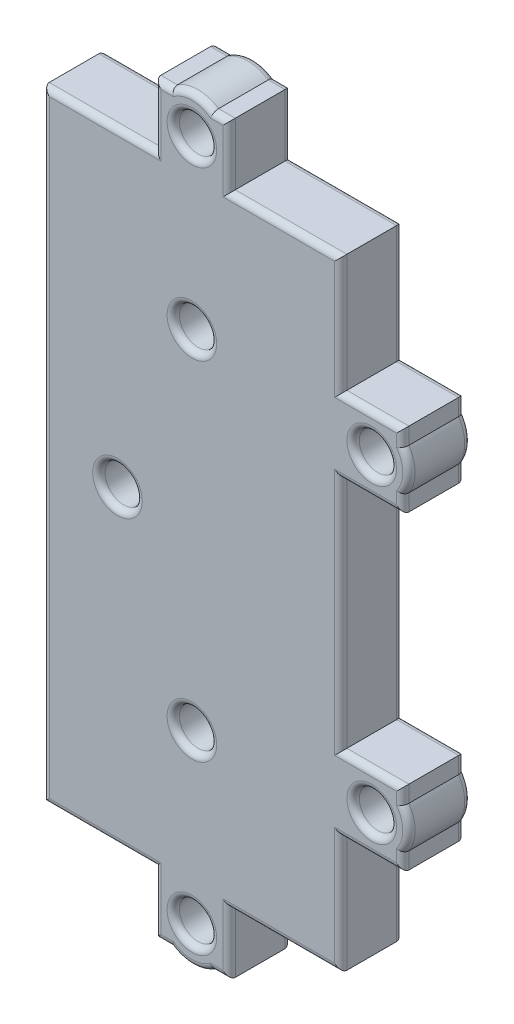
from build123d import *

# Parameters (mm, degrees)
ESQUISSE1_W             = 24
ESQUISSE1_H             = 50
ESQUISSE1_R             = 1.5
BOSS_EXTRU_1_DEPTH      = 5
ESQUISSE2_R             = 1.5
ENL_V_MAT_EXTRU_1_DEPTH = 5
CONG_1_R                = 0.5


with BuildPart() as part:
    # Esquisse1 → Boss.-Extru.1 (new body)
    # profile 1 of 5: a face of its own
    with BuildSketch(Plane.XY):
        Rectangle(ESQUISSE1_W, ESQUISSE1_H)
    # profile 2 of 5: a face of its own
    with BuildSketch(Plane.XY):
        with BuildLine():
            Line((17, 10.841687605), (17, 9.5))
            Line((17, 9.5), (12, 9.5))
            Line((12, 9.5), (12, 15.5))
            Line((12, 15.5), (17, 15.5))
            Line((17, 15.5), (17, 14.158312395))
            ThreePointArc((17, 14.158312395), (17.5, 12.5), (17, 10.841687605))
        make_face()
        with Locations((14.5, 12.5)):
            Circle(ESQUISSE1_R, mode=Mode.SUBTRACT)
    # profile 3 of 5: a face of its own
    with BuildSketch(Plane.XY):
        with BuildLine():
            Line((17, -15.5), (17, -14.158312395))
            ThreePointArc((17, -14.158312395), (17.5, -12.5), (17, -10.841687605))
            Line((17, -10.841687605), (17, -9.5))
            Line((17, -9.5), (12, -9.5))
            Line((12, -9.5), (12, -15.5))
            Line((12, -15.5), (17, -15.5))
        make_face()
        with Locations((14.5, -12.5)):
            Circle(ESQUISSE1_R, mode=Mode.SUBTRACT)
    # profile 4 of 5: a face of its own
    with BuildSketch(Plane.XY):
        with BuildLine():
            Line((1.658312395, 30), (3, 30))
            Line((3, 30), (3, 25))
            Line((3, 25), (-3, 25))
            Line((-3, 25), (-3, 30))
            Line((-3, 30), (-1.658312395, 30))
            ThreePointArc((-1.658312395, 30), (0, 30.5), (1.658312395, 30))
        make_face()
        with Locations((0, 27.5)):
            Circle(ESQUISSE1_R, mode=Mode.SUBTRACT)
    # profile 5 of 5: a face of its own
    with BuildSketch(Plane.XY):
        with BuildLine():
            Line((-3, -30), (-1.658312395, -30))
            ThreePointArc((-1.658312395, -30), (0, -30.5), (1.658312395, -30))
            Line((1.658312395, -30), (3, -30))
            Line((3, -30), (3, -25))
            Line((3, -25), (-3, -25))
            Line((-3, -25), (-3, -30))
        make_face()
        with Locations((0, -27.5)):
            Circle(ESQUISSE1_R, mode=Mode.SUBTRACT)
    extrude(amount=BOSS_EXTRU_1_DEPTH)

    # Esquisse2 → Enlèv. mat.-Extru.1 (cut)
    with BuildSketch(Plane.XY.offset(5)):
        with Locations((0, 14)):
            Circle(ESQUISSE2_R)
        with Locations((-6, 0)):
            Circle(ESQUISSE2_R)
        with Locations((0, -14)):
            Circle(ESQUISSE2_R)
    extrude(amount=-ENL_V_MAT_EXTRU_1_DEPTH, mode=Mode.SUBTRACT)

    # Congé1
    cong_1_edges = [part.edges().sort_by_distance(p)[0] for p in [
        (17, 10.170843802, 5),
        (17.5, 12.5, 5),
        (17, 14.829156198, 5),
        (14.5, 15.5, 5),
        (-1.5, 27.5, 5),
        (13, -12.5, 5),
        (13, 12.5, 5),
        (-1.5, 14, 0),
        (-1.5, 14, 5),
        (-7.5, 0, 0),
        (-7.5, 0, 5),
        (-1.5, -14, 0),
        (-1.5, -14, 5),
        (7.5, 25, 5),
        (3, 27.5, 5),
        (2.329156198, 30, 5),
        (13, 12.5, 0),
        (13, -12.5, 0),
        (-1.5, 27.5, 0),
        (14.5, 15.5, 0),
        (17, 14.829156198, 0),
        (17.5, 12.5, 0),
        (17, 10.170843802, 0),
        (0, 30.5, 5),
        (14.5, 9.5, 0),
        (12, 0, 0),
        (14.5, -9.5, 0),
        (17, -10.170843802, 0),
        (17.5, -12.5, 0),
        (17, -14.829156198, 0),
        (14.5, -15.5, 0),
        (12, -20.25, 0),
        (-7.5, -25, 0),
        (-2.329156198, 30, 5),
        (-12, 0, 0),
        (-7.5, 25, 0),
        (-3, 27.5, 0),
        (-2.329156198, 30, 0),
        (0, 30.5, 0),
        (2.329156198, 30, 0),
        (3, 27.5, 0),
        (7.5, 25, 0),
        (12, 20.25, 0),
        (-3, 27.5, 5),
        (-7.5, 25, 5),
        (-12, 0, 5),
        (-7.5, -25, 5),
        (12, -20.25, 5),
        (14.5, -15.5, 5),
        (17, -14.829156198, 5),
        (7.5, -25, 0),
        (7.5, -25, 5),
        (17.5, -12.5, 5),
        (12, 20.25, 5),
        (17, -10.170843802, 5),
        (0, -30.5, 5),
        (-2.329156198, -30, 5),
        (-3, -27.5, 5),
        (3, -27.5, 5),
        (2.329156198, -30, 5),
        (0, -30.5, 0),
        (-2.329156198, -30, 0),
        (-3, -27.5, 0),
        (14.5, -9.5, 5),
        (3, -27.5, 0),
        (2.329156198, -30, 0),
        (-1.5, -27.5, 5),
        (-1.5, -27.5, 0),
        (12, 0, 5),
        (14.5, 9.5, 5),
    ]]
    fillet(cong_1_edges, radius=CONG_1_R)


solid = part.part
